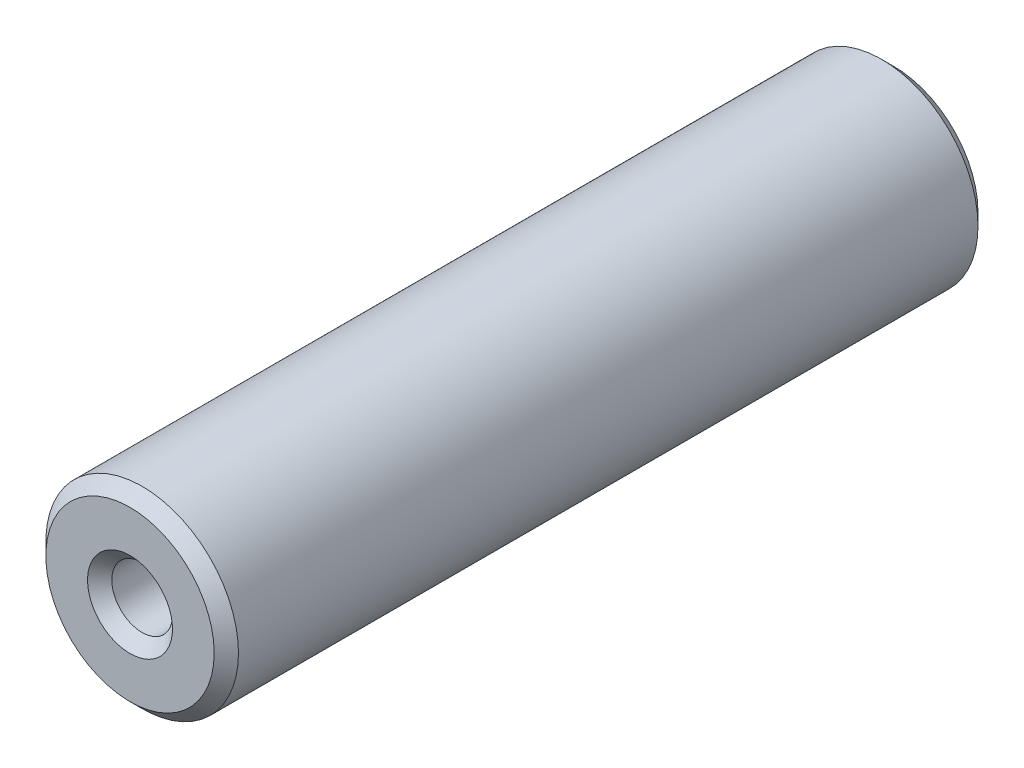
from build123d import *

# Parameters (mm, degrees)
SKETCH1_R           = 3.96875
BOSS_EXTRUDE1_DEPTH = 31.475
SKETCH3_R           = 1.25
CUT_EXTRUDE1_DEPTH  = 4.5
SKETCH4_R           = 1.352058412
CUT_EXTRUDE2_DEPTH  = 4.5
CHAMFER1_SIZE       = 0.5


with BuildPart() as part:
    # Sketch1 → Boss-Extrude1 (new body)
    with BuildSketch(Plane.XY):
        Circle(SKETCH1_R)
    extrude(amount=BOSS_EXTRUDE1_DEPTH)

    # Sketch3 → Cut-Extrude1 (cut)
    with BuildSketch(Plane.XY.offset(31.475)):
        Circle(SKETCH3_R)
    extrude(amount=-CUT_EXTRUDE1_DEPTH, mode=Mode.SUBTRACT)

    # Sketch4 → Cut-Extrude2 (cut)
    with BuildSketch(Plane(origin=(0, 0, 0), x_dir=(-1, 0, 0), z_dir=(0, 0, -1))):
        Circle(SKETCH4_R)
    extrude(amount=-CUT_EXTRUDE2_DEPTH, mode=Mode.SUBTRACT)

    # Chamfer1
    chamfer1_edges = [part.edges().sort_by_distance(p)[0] for p in [
        (1.352058412, 0, 0),
        (-3.96875, 0, 0),
        (-3.96875, 0, 31.475),
        (-1.25, 0, 31.475),
    ]]
    chamfer(chamfer1_edges, length=CHAMFER1_SIZE)


solid = part.part
